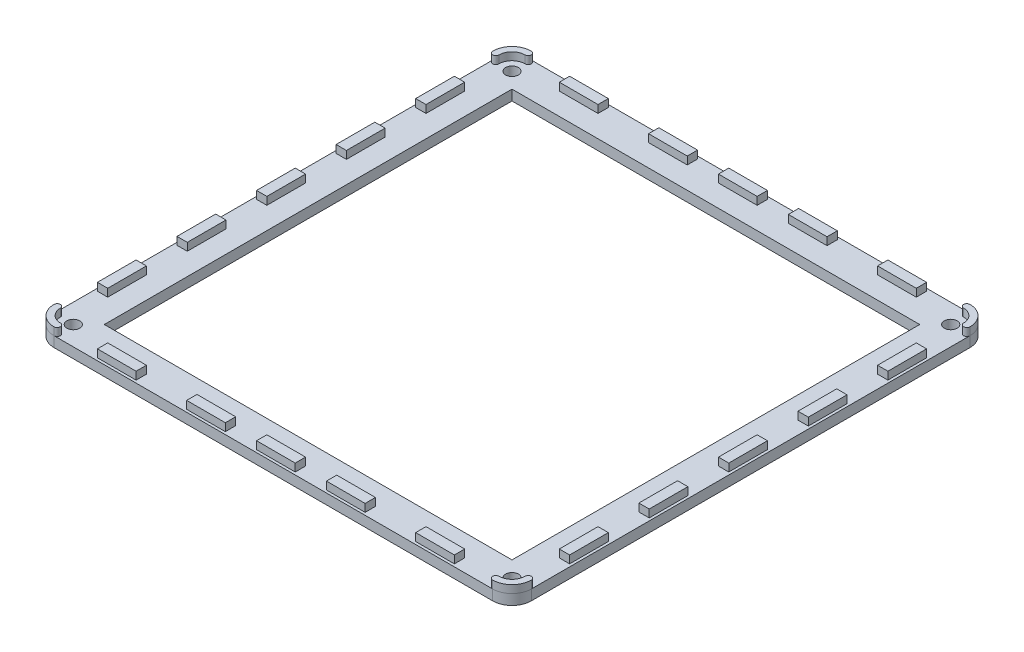
from build123d import *

# Parameters (mm, degrees)
CROQUIS1_R              = 2.499999999999999
CROQUIS1_R_2            = 2.4999999999999956
CROQUIS1_R_3            = 2.4999999999999982
SALIENTE_EXTRUIR1_DEPTH = 4
CROQUIS2_W              = 158.00000000000003
CROQUIS2_H              = 158
CORTAR_EXTRUIR1_DEPTH   = 10
CROQUIS4_W              = 4.000000000000028
CROQUIS4_H              = 15
CROQUIS4_W_2            = 4
CROQUIS4_H_2            = 14.999999999999972
CROQUIS4_H_3            = 15.000000000000028
CROQUIS4_W_3            = 15.000000000000007
CROQUIS4_H_4            = 4
CROQUIS4_W_4            = 14.999999999999986
CROQUIS4_W_5            = 15.000000000000028
SALIENTE_EXTRUIR2_DEPTH = 3
CORTAR_EXTRUIR2_DEPTH   = 5
REDONDEO1_R             = 7.5


with BuildPart() as part:
    # Croquis1 → Saliente-Extruir1 (new body)
    with BuildSketch(Plane(origin=(0, 0, 0), x_dir=(1, 0, 0), z_dir=(0, 1, 0))):
        Polygon((0, 0), (200, 0), (200, 200), (-2.776e-14, 200), align=None)
        with Locations(Location((14.99999999999995, 185.00000000000003, 0), (0, 0, 270))):
            Circle(CROQUIS1_R, mode=Mode.SUBTRACT)
        with Locations(Location((185, 185.00000000000003, 0), (0, 0, 270))):
            Circle(CROQUIS1_R_2, mode=Mode.SUBTRACT)
        with Locations(Location((185, 15.000000000000055, 0), (0, 0, 270))):
            Circle(CROQUIS1_R_2, mode=Mode.SUBTRACT)
        with Locations(Location((14.999999999999957, 15.000000000000007, 0), (0, 0, 270))):
            Circle(CROQUIS1_R_3, mode=Mode.SUBTRACT)
    extrude(amount=SALIENTE_EXTRUIR1_DEPTH)

    # Croquis2 → Cortar-Extruir1 (cut)
    with BuildSketch(Plane(origin=(0, 4, 0), x_dir=(1, 0, 0), z_dir=(0, 1, 0))):
        with Locations((100.00000000000001, 100.00000000000003)):
            Rectangle(CROQUIS2_W, CROQUIS2_H)
    extrude(amount=-CORTAR_EXTRUIR1_DEPTH, mode=Mode.SUBTRACT)

    # Croquis4 → Saliente-Extruir2 (add)
    with BuildSketch(Plane(origin=(0, 4, 0), x_dir=(1, 0, 0), z_dir=(0, 1, 0))):
        with Locations((10.499999999999982, 130.83333333333337)):
            Rectangle(CROQUIS4_W, CROQUIS4_H)
        with Locations((10.499999999999982, 161.66666666666669)):
            Rectangle(CROQUIS4_W_2, CROQUIS4_H_2)
        with Locations((189.50000000000009, 100.00000000000014)):
            Rectangle(CROQUIS4_W_2, CROQUIS4_H_3)
        with Locations((38.33333333333334, 189.5)):
            Rectangle(CROQUIS4_W_3, CROQUIS4_H_4)
        with Locations((72.91666666666669, 189.5)):
            Rectangle(CROQUIS4_W_4, CROQUIS4_H_4)
        Polygon((8.499999999999995, 107.50000000000003), (12.499999999999995, 107.50000000000003), (12.500000000000005, 92.5), (8.500000000000005, 92.5), align=None)
        with Locations((100, 189.5)):
            Rectangle(CROQUIS4_W_5, CROQUIS4_H_4)
        Polygon((191.5000000000001, 138.33333333333348), (187.50000000000006, 138.33333333333348), (187.50000000000009, 123.33333333333347), (191.50000000000014, 123.33333333333348), align=None)
        Polygon((191.50000000000003, 169.1666666666668), (187.50000000000003, 169.1666666666668), (187.50000000000006, 154.1666666666668), (191.50000000000006, 154.1666666666668), align=None)
        Polygon((169.16666666666666, 187.50000000000009), (154.16666666666666, 187.50000000000009), (154.16666666666666, 191.50000000000009), (169.16666666666663, 191.50000000000009), align=None)
        Polygon((134.58333333333334, 187.50000000000006), (119.58333333333331, 187.50000000000003), (119.58333333333331, 191.50000000000003), (134.58333333333334, 191.50000000000006), align=None)
        Polygon((8.50000000000002, 61.666666666666664), (12.500000000000048, 61.666666666666664), (12.500000000000027, 76.66666666666666), (8.499999999999998, 76.66666666666666), align=None)
        Polygon((8.500000000000071, 30.833333333333325), (12.500000000000073, 30.83333333333335), (12.500000000000055, 45.83333333333332), (8.500000000000055, 45.83333333333332), align=None)
        Polygon((30.83333333333346, 12.500000000000039), (45.83333333333347, 12.500000000000068), (45.83333333333347, 8.500000000000064), (30.833333333333467, 8.500000000000036), align=None)
        Polygon((65.41666666666679, 12.500000000000094), (80.41666666666679, 12.500000000000123), (80.4166666666668, 8.500000000000119), (65.4166666666668, 8.50000000000009), align=None)
        Polygon((107.50000000000013, 12.50000000000015), (92.5000000000001, 12.500000000000123), (92.5000000000001, 8.500000000000119), (107.50000000000013, 8.500000000000146), align=None)
        Polygon((134.58333333333346, 8.500000000000119), (134.58333333333346, 12.500000000000123), (119.58333333333343, 12.50000000000015), (119.58333333333343, 8.500000000000146), align=None)
        Polygon((169.16666666666674, 8.500000000000146), (169.16666666666677, 12.50000000000015), (154.16666666666677, 12.500000000000123), (154.16666666666677, 8.500000000000119), align=None)
        Polygon((191.5000000000001, 45.83333333333345), (191.50000000000014, 30.833333333333464), (187.50000000000014, 30.833333333333464), (187.5000000000001, 45.83333333333345), align=None)
        Polygon((191.5000000000002, 76.66666666666677), (191.50000000000017, 61.666666666666785), (187.5000000000001, 61.666666666666785), (187.50000000000014, 76.66666666666679), align=None)
        with BuildLine():
            ThreePointArc((14.99999999999995, 192.50000000000003), (9.696699141100844, 190.30330085889915), (7.499999999999951, 185.00000000000003))
            ThreePointArc((7.499999999999951, 185.00000000000003), (8.74999999999995, 183.75000000000003), (9.99999999999995, 185.00000000000003))
            ThreePointArc((9.99999999999995, 185.00000000000003), (11.464466094067213, 188.53553390593277), (14.99999999999995, 190.00000000000003))
            ThreePointArc((14.99999999999995, 190.00000000000003), (16.24999999999995, 191.25000000000003), (14.99999999999995, 192.50000000000003))
        make_face()
        with BuildLine():
            ThreePointArc((185.00000000000003, 192.50000000000014), (190.30330085889915, 190.30330085889926), (192.50000000000006, 185.00000000000014))
            ThreePointArc((192.50000000000006, 185.00000000000014), (191.25000000000006, 183.75000000000014), (190.00000000000006, 185.00000000000014))
            ThreePointArc((190.00000000000006, 185.00000000000014), (188.5355339059328, 188.53553390593288), (185.00000000000003, 190.00000000000014))
            ThreePointArc((185.00000000000003, 190.00000000000014), (183.75000000000003, 191.25000000000014), (185.00000000000003, 192.50000000000014))
        make_face()
        with BuildLine():
            ThreePointArc((15.000000000000073, 7.500000000000007), (9.696699141100964, 9.69669914110089), (7.500000000000062, 14.999999999999986))
            ThreePointArc((7.500000000000062, 14.999999999999986), (8.750000000000062, 16.249999999999986), (10.00000000000006, 14.999999999999986))
            ThreePointArc((10.00000000000006, 14.999999999999986), (11.464466094067335, 11.46446609406726), (15.000000000000071, 10.000000000000009))
            ThreePointArc((15.000000000000071, 10.000000000000009), (16.250000000000075, 8.750000000000007), (15.000000000000073, 7.500000000000007))
        make_face()
        with BuildLine():
            ThreePointArc((185.00000000000014, 10.00000000000012), (183.75000000000014, 8.750000000000119), (185.00000000000014, 7.500000000000117))
            ThreePointArc((185.00000000000014, 7.500000000000117), (190.30330085889926, 9.696699141101004), (192.50000000000017, 15.000000000000124))
            ThreePointArc((192.50000000000017, 15.000000000000124), (191.25000000000017, 16.250000000000124), (190.00000000000017, 15.000000000000124))
            ThreePointArc((190.00000000000017, 15.000000000000124), (188.5355339059329, 11.464466094067374), (185.00000000000014, 10.00000000000012))
        make_face()
    extrude(amount=SALIENTE_EXTRUIR2_DEPTH)

    # Croquis5 → Cortar-Extruir2 (cut)
    with BuildSketch(Plane(origin=(0, 4, 0), x_dir=(1, 0, 0), z_dir=(0, 1, 0))):
        Polygon((200, 200), (-2.776e-14, 200), (0, 0), (200, 0), align=None)
        Polygon((192.5, 192.5), (7.500000000000001, 192.49999999999997), (7.500000000000023, 7.5), (192.5, 7.500000000000011), align=None, mode=Mode.SUBTRACT)
    extrude(amount=-CORTAR_EXTRUIR2_DEPTH, mode=Mode.SUBTRACT)

    # Redondeo1
    redondeo1_edges = [part.edges().sort_by_distance(p)[0] for p in [
        (7.500000000000023, 2, -7.5),
        (7.500000000000001, 2, -192.49999999999997),
        (192.5, 2, -192.5),
        (192.5, 2, -7.500000000000011),
    ]]
    fillet(redondeo1_edges, radius=REDONDEO1_R)


solid = part.part
